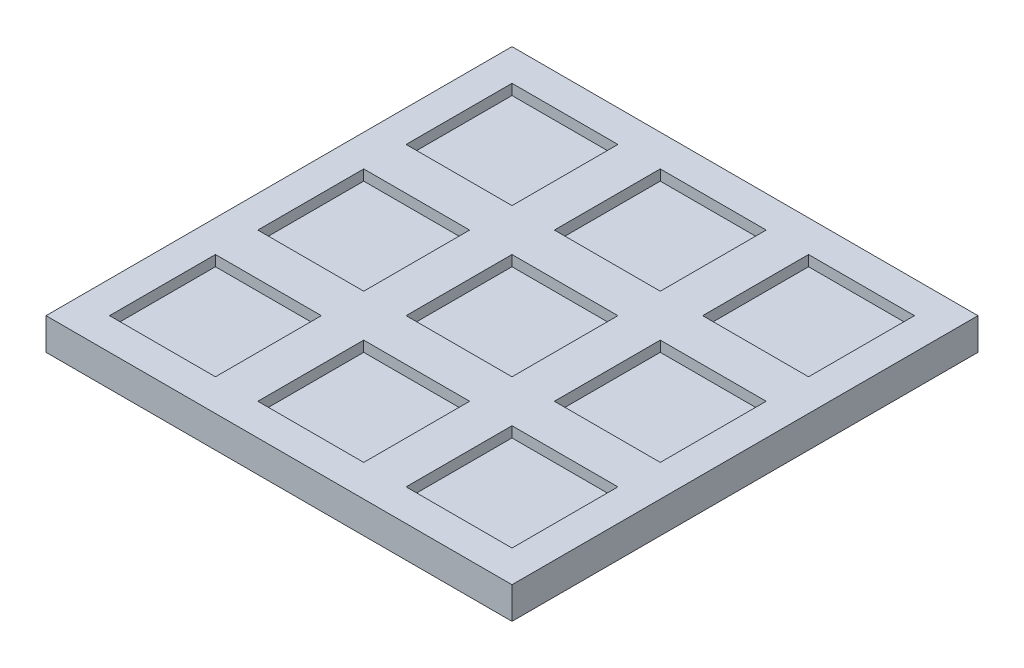
from build123d import *

# Parameters (mm, degrees)
SKETCH1_W           = 44
SKETCH1_H           = 44
BOSS_EXTRUDE2_DEPTH = 2
SKETCH1_5_W         = 44
SKETCH1_5_H         = 44
SKETCH1_5_W_2       = 10
SKETCH1_5_H_2       = 10
BOSS_EXTRUDE3_DEPTH = 1


with BuildPart() as part:
    # Sketch1 → Boss-Extrude2 (new body)
    with BuildSketch(Plane(origin=(0, 0, 0), x_dir=(1, 0, 0), z_dir=(0, 1, 0))):
        with Locations((-7, -14)):
            Rectangle(SKETCH1_W, SKETCH1_H)
    extrude(amount=-BOSS_EXTRUDE2_DEPTH)

    # Sketch1<5> → Boss-Extrude3 (add)
    with BuildSketch(Plane(origin=(0, 0, 0), x_dir=(1, 0, 0), z_dir=(0, 1, 0))):
        with Locations((-7, -14)):
            Rectangle(SKETCH1_5_W, SKETCH1_5_H)
        with Locations((-21, -28)):
            Rectangle(SKETCH1_5_W_2, SKETCH1_5_H_2, mode=Mode.SUBTRACT)
        with Locations((-7, -28)):
            Rectangle(SKETCH1_5_W_2, SKETCH1_5_H_2, mode=Mode.SUBTRACT)
        with Locations((7, -28)):
            Rectangle(SKETCH1_5_W_2, SKETCH1_5_H_2, mode=Mode.SUBTRACT)
        with Locations((-21, -14)):
            Rectangle(SKETCH1_5_W_2, SKETCH1_5_H_2, mode=Mode.SUBTRACT)
        with Locations((-21, 0)):
            Rectangle(SKETCH1_5_W_2, SKETCH1_5_H_2, mode=Mode.SUBTRACT)
        with Locations((-7, -14)):
            Rectangle(SKETCH1_5_W_2, SKETCH1_5_H_2, mode=Mode.SUBTRACT)
        with Locations((7, -14)):
            Rectangle(SKETCH1_5_W_2, SKETCH1_5_H_2, mode=Mode.SUBTRACT)
        with Locations((-7, 0)):
            Rectangle(SKETCH1_5_W_2, SKETCH1_5_H_2, mode=Mode.SUBTRACT)
        with Locations((7, 0)):
            Rectangle(SKETCH1_5_W_2, SKETCH1_5_H_2, mode=Mode.SUBTRACT)
    extrude(amount=BOSS_EXTRUDE3_DEPTH)


solid = part.part
